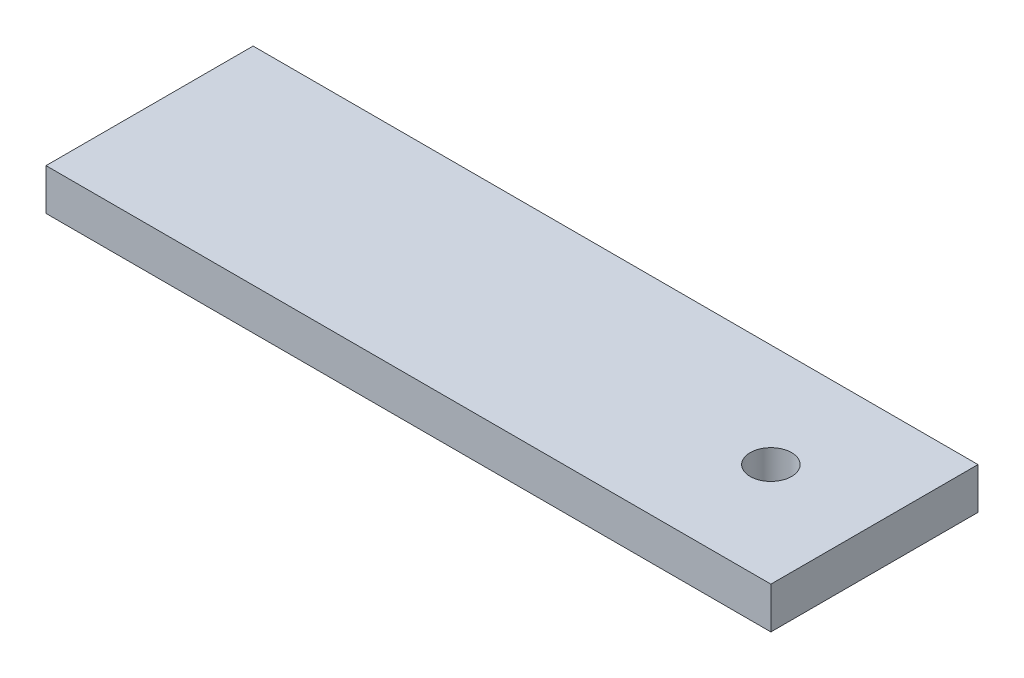
from build123d import *

# Parameters (mm, degrees)
SKETCH1_W           = 70
SKETCH1_H           = 20
BOSS_EXTRUDE1_DEPTH = 4
SKETCH2_R           = 2
CUT_EXTRUDE1_DEPTH  = 4


with BuildPart() as part:
    # Sketch1 → Boss-Extrude1 (new body)
    with BuildSketch(Plane(origin=(0, 0, 0), x_dir=(1, 0, 0), z_dir=(0, 1, 0))):
        with Locations((35, 10)):
            Rectangle(SKETCH1_W, SKETCH1_H)
    extrude(amount=BOSS_EXTRUDE1_DEPTH)

    # Sketch2 → Cut-Extrude1 (cut)
    with BuildSketch(Plane(origin=(0, 4, 0), x_dir=(1, 0, 0), z_dir=(0, 1, 0))):
        with Locations(Location((60, 10, 0), (0, 0, 270))):
            Circle(SKETCH2_R)
    extrude(amount=-CUT_EXTRUDE1_DEPTH, mode=Mode.SUBTRACT)


solid = part.part
